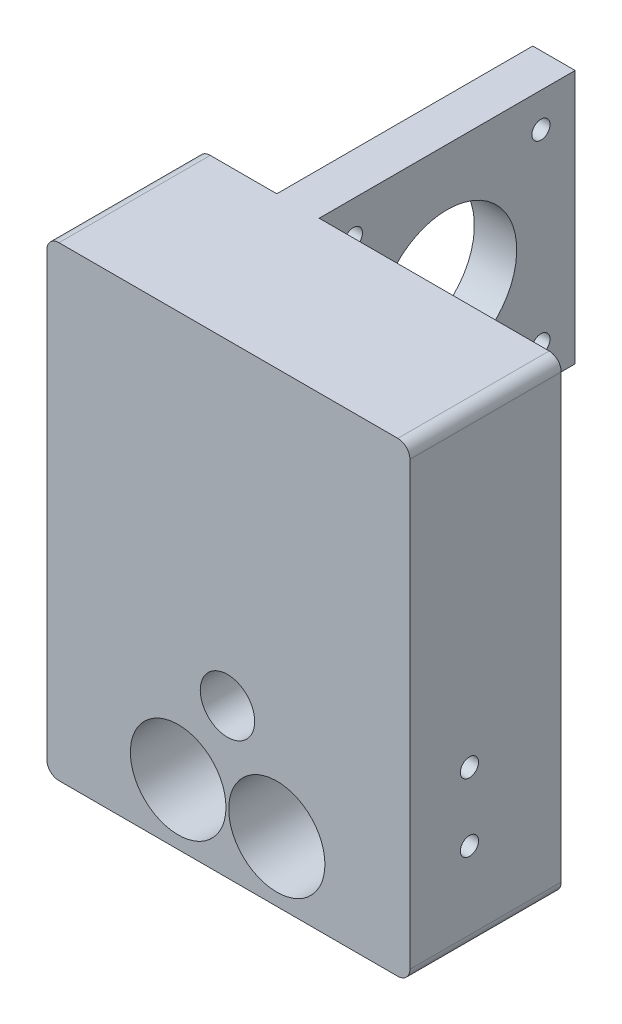
from build123d import *

# Parameters (mm, degrees)
ESQUISSE1_W              = 100
ESQUISSE1_H              = 100
BOSS_EXTRU_1_DEPTH       = 25
ESQUISSE2_R              = 7.9
ESQUISSE2_R_2            = 7.95
ESQUISSE2_R_3            = 4.5
ENL_V_MAT_EXTRU_1_DEPTH  = 144.614066163
ESQUISSE3_R              = 4.3
ENL_V_MAT_EXTRU_3_DEPTH  = 10
ESQUISSE4_W              = 7
ESQUISSE4_H              = 42
BOSS_EXTRU_2_DEPTH       = 42.3
ESQUISSE5_R              = 1.5
ENL_V_MAT_EXTRU_4_DEPTH  = 12
ESQUISSE6_W              = 40
ESQUISSE6_H              = 100
ENL_V_MAT_EXTRU_6_DEPTH  = 148.61195751
ENL_V_MAT_EXTRU_8_DEPTH  = 7.5
ESQUISSE10_R             = 11.5
ENL_V_MAT_EXTRU_10_DEPTH = 119.314369372
ESQUISSE11_R             = 1.5
ENL_V_MAT_EXTRU_11_DEPTH = 3
ESQUISSE12_W             = 60
ESQUISSE12_H             = 23
ENL_V_MAT_EXTRU_12_DEPTH = 148.61195751
CONG_1_R                 = 2


with BuildPart() as part:
    # Esquisse1 → Boss.-Extru.1 (new body)
    with BuildSketch(Plane.XY):
        with Locations((50, 50)):
            Rectangle(ESQUISSE1_W, ESQUISSE1_H)
    extrude(amount=BOSS_EXTRU_1_DEPTH)

    # Esquisse2 → Enlèv. mat.-Extru.1 (cut, through all)
    with BuildSketch(Plane.XY):
        with Locations((61.7000009, 9.994583957)):
            Circle(ESQUISSE2_R)
        with Locations((78, 10)):
            Circle(ESQUISSE2_R_2)
        with Locations((69.845134328, 24.642259589)):
            Circle(ESQUISSE2_R_3)
    extrude(amount=ENL_V_MAT_EXTRU_1_DEPTH, mode=Mode.SUBTRACT)

    # Esquisse3 → Enlèv. mat.-Extru.3 (cut)
    with BuildSketch(Plane(origin=(0, 0, 0), x_dir=(1, 0, 0), z_dir=(0, 1, 0))):
        with Locations(Location((48, -12.5, 0), (0, 0, 270))):
            Circle(ESQUISSE3_R)
        with Locations(Location((92, -12.5, 0), (0, 0, 270))):
            Circle(ESQUISSE3_R)
    extrude(amount=ENL_V_MAT_EXTRU_3_DEPTH, mode=Mode.SUBTRACT)

    # Esquisse4 → Boss.-Extru.2 (add)
    with BuildSketch(Plane.XY):
        with Locations((56.5, 56)):
            Rectangle(ESQUISSE4_W, ESQUISSE4_H)
    extrude(amount=-BOSS_EXTRU_2_DEPTH)

    # Esquisse5 → Enlèv. mat.-Extru.4 (cut)
    with BuildSketch(Plane(origin=(60, 0, 0), x_dir=(0, 0, -1), z_dir=(1, 0, 0))):
        with Locations(Location((36.65, 71.35, 0), (0, 0, 90))):
            Circle(ESQUISSE5_R)
        with Locations(Location((36.65, 40.65, 0), (0, 0, 90))):
            Circle(ESQUISSE5_R)
        with Locations(Location((5.65, 40.65, 0), (0, 0, 90))):
            Circle(ESQUISSE5_R)
        with Locations(Location((5.65, 71.35, 0), (0, 0, 90))):
            Circle(ESQUISSE5_R)
    extrude(amount=-ENL_V_MAT_EXTRU_4_DEPTH, mode=Mode.SUBTRACT)

    # Esquisse6 → Enlèv. mat.-Extru.6 (cut, through all)
    with BuildSketch(Plane.XY):
        with Locations((20, 50)):
            Rectangle(ESQUISSE6_W, ESQUISSE6_H)
    extrude(amount=ENL_V_MAT_EXTRU_6_DEPTH, mode=Mode.SUBTRACT)

    # Esquisse8 → Enlèv. mat.-Extru.8 (cut)
    with BuildSketch(Plane(origin=(0, 0, 0), x_dir=(-1, 0, 0), z_dir=(0, 0, -1))):
        Polygon((-62.690994399, 21.852704928), (-63.852239162, 29.44314918), (-71.006379091, 32.232703841), (-76.999274258, 27.43181425), (-75.838029495, 19.841369999), (-68.683889565, 17.051815338), align=None)
    extrude(amount=-ENL_V_MAT_EXTRU_8_DEPTH, mode=Mode.SUBTRACT)

    # Esquisse10 → Enlèv. mat.-Extru.10 (cut, through all)
    with BuildSketch(Plane.ZY.offset(-53)):
        with Locations((-21.15, 56.15)):
            Circle(ESQUISSE10_R)
    extrude(amount=-ENL_V_MAT_EXTRU_10_DEPTH, mode=Mode.SUBTRACT)

    # Esquisse11 → Enlèv. mat.-Extru.11 (cut)
    with BuildSketch(Plane(origin=(100, 0, 0), x_dir=(0, 0, -1), z_dir=(1, 0, 0))):
        with Locations((-15.163954836, 26)):
            Circle(ESQUISSE11_R)
        with Locations((-15.163954836, 14.75187619)):
            Circle(ESQUISSE11_R)
    extrude(amount=-ENL_V_MAT_EXTRU_11_DEPTH, mode=Mode.SUBTRACT)

    # Esquisse12 → Enlèv. mat.-Extru.12 (cut, through all)
    with BuildSketch(Plane(origin=(0, 0, 0), x_dir=(-1, 0, 0), z_dir=(0, 0, -1))):
        with Locations((-70, 88.5)):
            Rectangle(ESQUISSE12_W, ESQUISSE12_H)
    extrude(amount=-ENL_V_MAT_EXTRU_12_DEPTH, mode=Mode.SUBTRACT)

    # Congé1
    cong_1_edges = [part.edges().sort_by_distance(p)[0] for p in [
        (100, 77, 12.5),
        (40, 77, 12.5),
        (40, 0, 12.5),
        (100, 0, 12.5),
    ]]
    fillet(cong_1_edges, radius=CONG_1_R)


solid = part.part
